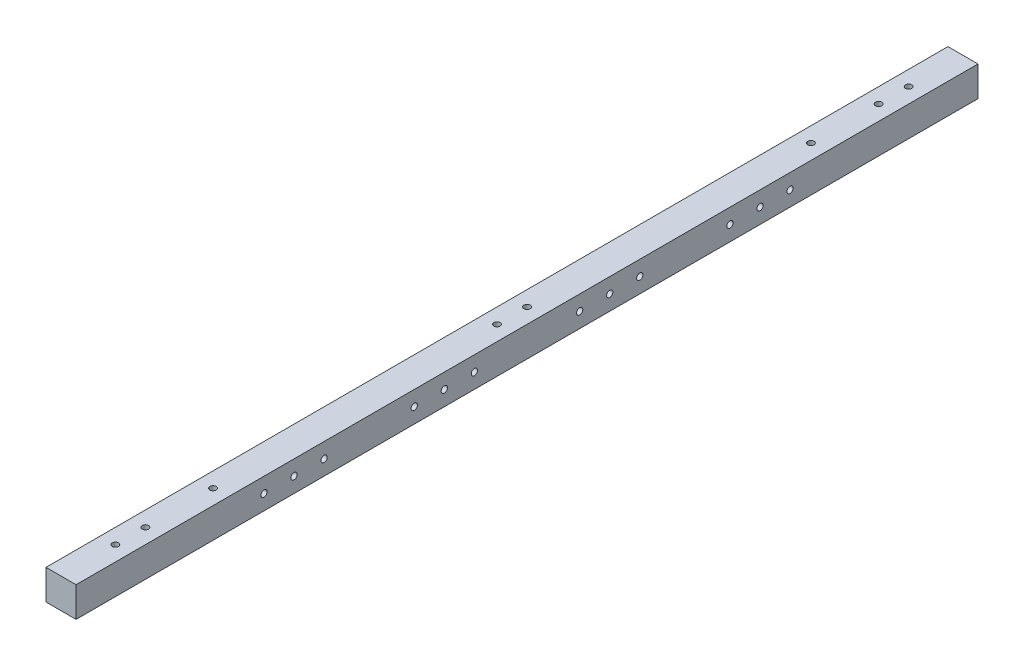
from build123d import *

# Parameters (mm, degrees)
SKETCH_1_W          = 20
SKETCH_1_H          = 20
EXTRUDE_1_DEPTH     = 600
SKETCH_2_R          = 2.1
CUT_EXTRUDE_1_DEPTH = 30
SKETCH_3_R          = 2.1
CUT_EXTRUDE_2_DEPTH = 601.416522091
SKETCH_4_R          = 2.1
CUT_EXTRUDE_3_DEPTH = 601.416522091


with BuildPart() as part:
    # 草图1 → 凸台-拉伸1 (new body)
    with BuildSketch(Plane.XY):
        Rectangle(SKETCH_1_W, SKETCH_1_H)
    extrude(amount=EXTRUDE_1_DEPTH)

    # 草图2 → 切除-拉伸1 (cut)
    with BuildSketch(Plane(origin=(0, 10, 0), x_dir=(1, 0, 0), z_dir=(0, 1, 0))):
        with Locations(Location((0, -36.12, 0), (0, 0, 270))):
            Circle(SKETCH_2_R)
        with Locations(Location((0, -56.12, 0), (0, 0, 270))):
            Circle(SKETCH_2_R)
        with Locations(Location((0, -101.12, 0), (0, 0, 270))):
            Circle(SKETCH_2_R)
    cut_extrude_1 = extrude(amount=-CUT_EXTRUDE_1_DEPTH, mode=Mode.SUBTRACT)

    # 镜向1: 切除-拉伸1 across plane
    add(cut_extrude_1.mirror(Plane(origin=(0, 0, 300), x_dir=(1, 0, 0), z_dir=(0, 0, -1))), mode=Mode.SUBTRACT)

    # 草图3 → 切除-拉伸2 (cut, through all)
    with BuildSketch(Plane.ZY.offset(10)):
        with Locations((225, 0)):
            Circle(SKETCH_3_R)
        with Locations((245, 0)):
            Circle(SKETCH_3_R)
        with Locations((265, 0)):
            Circle(SKETCH_3_R)
        with Locations(Location((375, 0, 0), (0, 0, 180))):
            Circle(SKETCH_3_R)
        with Locations(Location((355, 0, 0), (0, 0, 180))):
            Circle(SKETCH_3_R)
        with Locations(Location((335, 0, 0), (0, 0, 180))):
            Circle(SKETCH_3_R)
        with Locations((435, 0)):
            Circle(SKETCH_3_R)
        with Locations((455, 0)):
            Circle(SKETCH_3_R)
        with Locations((475, 0)):
            Circle(SKETCH_3_R)
        with Locations(Location((125, 0, 0), (0, 0, 180))):
            Circle(SKETCH_3_R)
        with Locations(Location((145, 0, 0), (0, 0, 180))):
            Circle(SKETCH_3_R)
        with Locations(Location((165, 0, 0), (0, 0, 180))):
            Circle(SKETCH_3_R)
    extrude(amount=-CUT_EXTRUDE_2_DEPTH, mode=Mode.SUBTRACT)

    # 草图4 → 切除-拉伸3 (cut, through all)
    with BuildSketch(Plane(origin=(0, 10, 0), x_dir=(1, 0, 0), z_dir=(0, 1, 0))):
        with Locations(Location((0, -310, 0), (0, 0, 270))):
            Circle(SKETCH_4_R)
        with Locations(Location((0, -290, 0), (0, 0, 90))):
            Circle(SKETCH_4_R)
    extrude(amount=-CUT_EXTRUDE_3_DEPTH, mode=Mode.SUBTRACT)


solid = part.part
